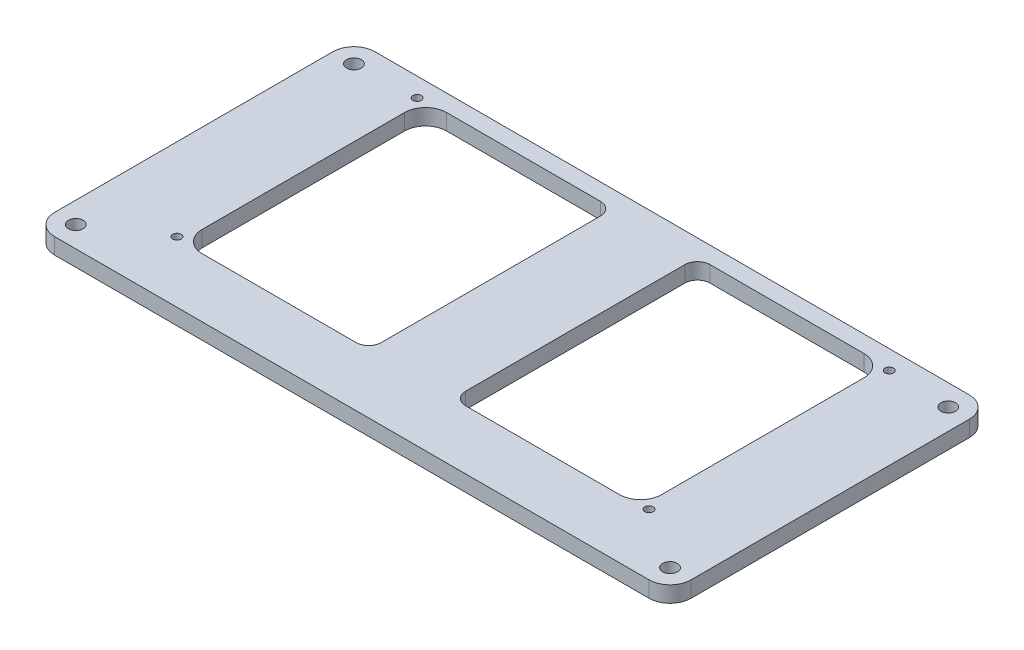
from build123d import *

# Parameters (mm, degrees)
SKETCH1_W           = 121
SKETCH1_H           = 66
BOSS_EXTRUDE1_DEPTH = 3.8
SKETCH2_W           = 109
SKETCH2_H           = 58
CUT_EXTRUDE1_DEPTH  = 138.881978518
FILLET1_R           = 5
SKETCH3_W           = 20
SKETCH3_H           = 58
BOSS_EXTRUDE2_DEPTH = 3.8
FILLET2_R           = 3
SKETCH4_R           = 1
CUT_EXTRUDE2_DEPTH  = 138.881978518
BOSS_EXTRUDE3_DEPTH = 3.8
SKETCH6_R           = 1.75
CUT_EXTRUDE3_DEPTH  = 156.841072892
FILLET3_R           = 5


with BuildPart() as part:
    # Sketch1 → Boss-Extrude1 (new body)
    with BuildSketch(Plane(origin=(0, 0, 0), x_dir=(1, 0, 0), z_dir=(0, 1, 0))):
        with Locations((60.5, -33)):
            Rectangle(SKETCH1_W, SKETCH1_H)
    extrude(amount=BOSS_EXTRUDE1_DEPTH)

    # Sketch2 → Cut-Extrude1 (cut, through all)
    with BuildSketch(Plane(origin=(0, 3.8, 0), x_dir=(1, 0, 0), z_dir=(0, 1, 0))):
        with Locations((60.5, -33)):
            Rectangle(SKETCH2_W, SKETCH2_H)
    extrude(amount=-CUT_EXTRUDE1_DEPTH, mode=Mode.SUBTRACT)

    # Fillet1
    fillet1_edges = [part.edges().sort_by_distance(p)[0] for p in [
        (115, 1.9, 4),
        (115, 1.9, 62),
        (6, 1.9, 62),
        (6, 1.9, 4),
    ]]
    fillet(fillet1_edges, radius=FILLET1_R)

    # Sketch3 → Boss-Extrude2 (add, through all)
    with BuildSketch(Plane(origin=(0, 3.8, 0), x_dir=(1, 0, 0), z_dir=(0, 1, 0))):
        with Locations((60.5, -33)):
            Rectangle(SKETCH3_W, SKETCH3_H)
    extrude(amount=-BOSS_EXTRUDE2_DEPTH)

    # Fillet2
    fillet2_edges = [part.edges().sort_by_distance(p)[0] for p in [
        (70.5, 1.9, 4),
        (70.5, 1.9, 62),
        (50.5, 1.9, 62),
        (50.5, 1.9, 4),
    ]]
    fillet(fillet2_edges, radius=FILLET2_R)

    # Sketch4 → Cut-Extrude2 (cut, through all)
    with BuildSketch(Plane(origin=(0, 3.8, 0), x_dir=(1, 0, 0), z_dir=(0, 1, 0))):
        with Locations(Location((116.5, -61.5, 0), (0, 0, 270))):
            Circle(SKETCH4_R)
        with Locations(Location((116.5, -4.5, 0), (0, 0, 270))):
            Circle(SKETCH4_R)
        with Locations(Location((4.5, -4.5, 0), (0, 0, 270))):
            Circle(SKETCH4_R)
        with Locations(Location((4.5, -61.5, 0), (0, 0, 270))):
            Circle(SKETCH4_R)
    extrude(amount=-CUT_EXTRUDE2_DEPTH, mode=Mode.SUBTRACT)

    # Sketch5 → Boss-Extrude3 (add, through all)
    with BuildSketch(Plane(origin=(0, 3.8, 0), x_dir=(1, 0, 0), z_dir=(0, 1, 0))):
        Polygon((0, 0), (-15, 0), (-15, -76), (136, -76), (136, 0), (121, 0), (121, -66), (0, -66), align=None)
    extrude(amount=-BOSS_EXTRUDE3_DEPTH)

    # Sketch6 → Cut-Extrude3 (cut, through all)
    with BuildSketch(Plane(origin=(0, 0, 0), x_dir=(-1, 0, 0), z_dir=(0, -1, 0))):
        with Locations(Location((10, -71, 0), (0, 0, 90))):
            Circle(SKETCH6_R)
        with Locations(Location((10, -5, 0), (0, 0, 90))):
            Circle(SKETCH6_R)
        with Locations(Location((-131, -71, 0), (0, 0, 90))):
            Circle(SKETCH6_R)
        with Locations(Location((-131, -5, 0), (0, 0, 90))):
            Circle(SKETCH6_R)
    extrude(amount=-CUT_EXTRUDE3_DEPTH, mode=Mode.SUBTRACT)

    # Fillet3
    fillet3_edges = [part.edges().sort_by_distance(p)[0] for p in [
        (136, 1.9, 0),
        (136, 1.9, 76),
        (-15, 1.9, 76),
        (-15, 1.9, 0),
    ]]
    fillet(fillet3_edges, radius=FILLET3_R)


solid = part.part
